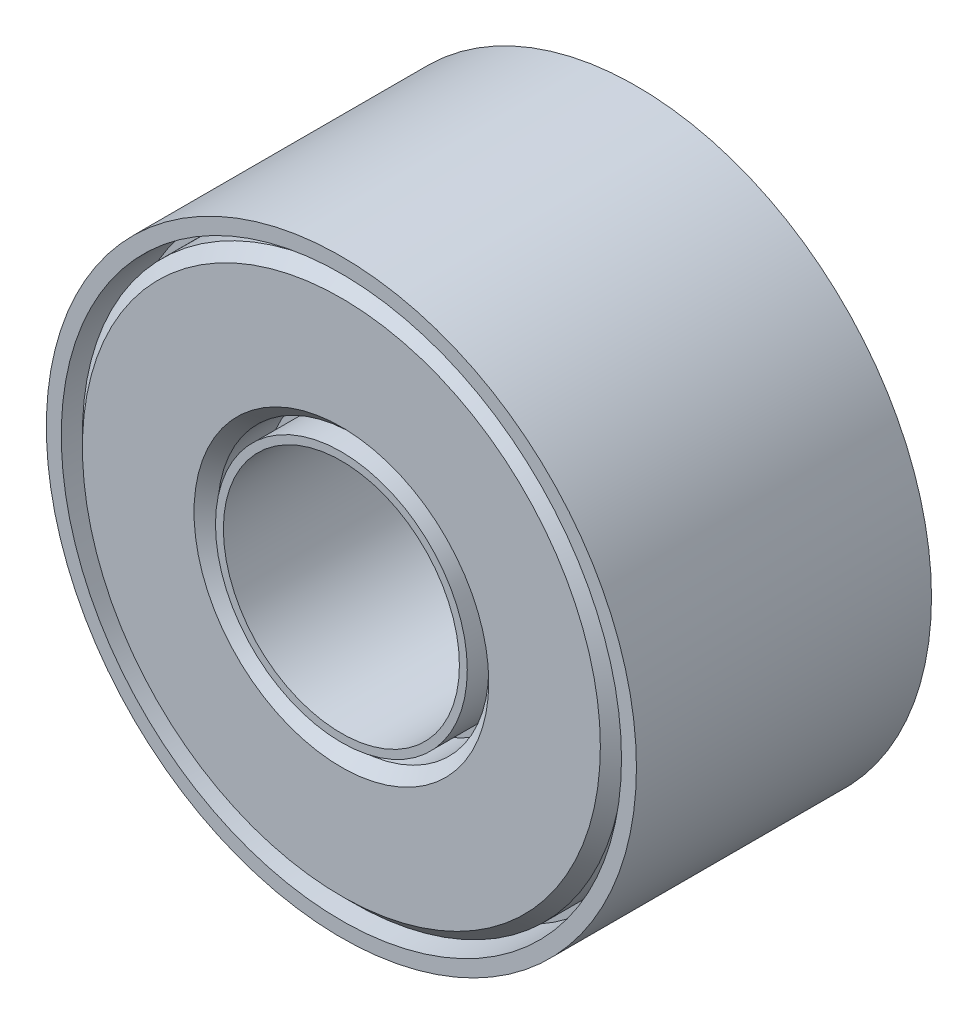
from build123d import *

# Parameters (mm, degrees)
SKETCH1_R           = 2.5
SKETCH1_R_2         = 1
BOSS_EXTRUDE1_DEPTH = 2.5
SKETCH2_R           = 2.373453331
SKETCH2_R_2         = 2.294274522
SKETCH2_R_3         = 1.148633929
SKETCH2_R_4         = 1.066697382
CUT_EXTRUDE1_DEPTH  = 0.5
CHAMFER1_SIZE       = 0.1
CHAMFER2_SIZE       = 0.1


with BuildPart() as part:
    # Sketch1 → Boss-Extrude1 (new body)
    with BuildSketch(Plane.XY):
        Circle(SKETCH1_R)
        Circle(SKETCH1_R_2, mode=Mode.SUBTRACT)
    extrude(amount=BOSS_EXTRUDE1_DEPTH)

    # Sketch2 → Cut-Extrude1 (cut)
    # profile 1 of 2: a face of its own
    with BuildSketch(Plane.XY.offset(2.5)):
        Circle(SKETCH2_R)
        Circle(SKETCH2_R_2, mode=Mode.SUBTRACT)
    # profile 2 of 2: a face of its own
    with BuildSketch(Plane.XY.offset(2.5)):
        Circle(SKETCH2_R_3)
        Circle(SKETCH2_R_4, mode=Mode.SUBTRACT)
    cut_extrude1 = extrude(amount=-CUT_EXTRUDE1_DEPTH, mode=Mode.SUBTRACT)

    # Chamfer1
    chamfer1_edges = [part.edges().sort_by_distance(p)[0] for p in [
        (-2.294274522, 0, 2.5),
        (-1.148633929, 0, 2.5),
    ]]
    chamfer(chamfer1_edges, length=CHAMFER1_SIZE)

    # Mirror3: Cut-Extrude1 across plane
    add(cut_extrude1.mirror(Plane(origin=(0, 0, 1.25), x_dir=(1, 0, 0), z_dir=(0, 0, -1))), mode=Mode.SUBTRACT)

    # Chamfer2
    chamfer2_edges = [part.edges().sort_by_distance(p)[0] for p in [
        (-2.294274522, 0, 0),
        (-1.148633929, 0, 0),
    ]]
    chamfer(chamfer2_edges, length=CHAMFER2_SIZE)


solid = part.part
